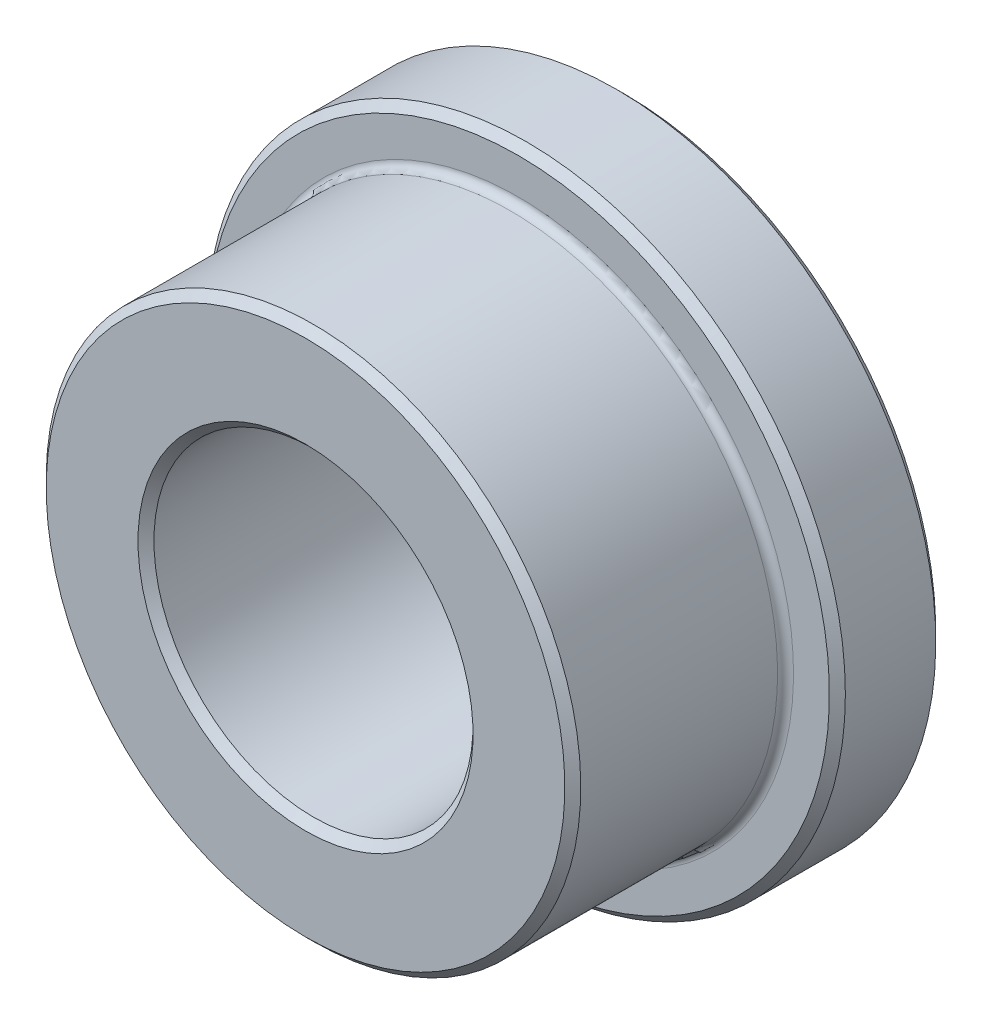
from build123d import *

# Parameters (mm, degrees)
CHAMFER1_SIZE = 0.15
FILLET1_R     = 0.15


with BuildPart() as part:
    # Sketch3 → Revolve1 (revolve)
    with BuildSketch(Plane(origin=(0, 0, 0), x_dir=(0, 0, -1), z_dir=(1, 0, 0))):
        Polygon((3, 6), (1, 6), (1, 5.0255), (-3, 5.0255), (-3, 3), (3, 3), align=None)
    revolve(axis=Axis((0, 0, -3), (0, 0, 1)))

    # Chamfer1
    chamfer1_edges = [part.edges().sort_by_distance(p)[0] for p in [
        (0, -3, 3),
        (0, -5.0255, 3),
        (0, -6, -1),
        (0, -6, -3),
    ]]
    chamfer(chamfer1_edges, length=CHAMFER1_SIZE)

    # Fillet1
    fillet1_edges = [part.edges().sort_by_distance(p)[0] for p in [
        (0, -5.0255, -1),
    ]]
    fillet(fillet1_edges, radius=FILLET1_R)


solid = part.part
